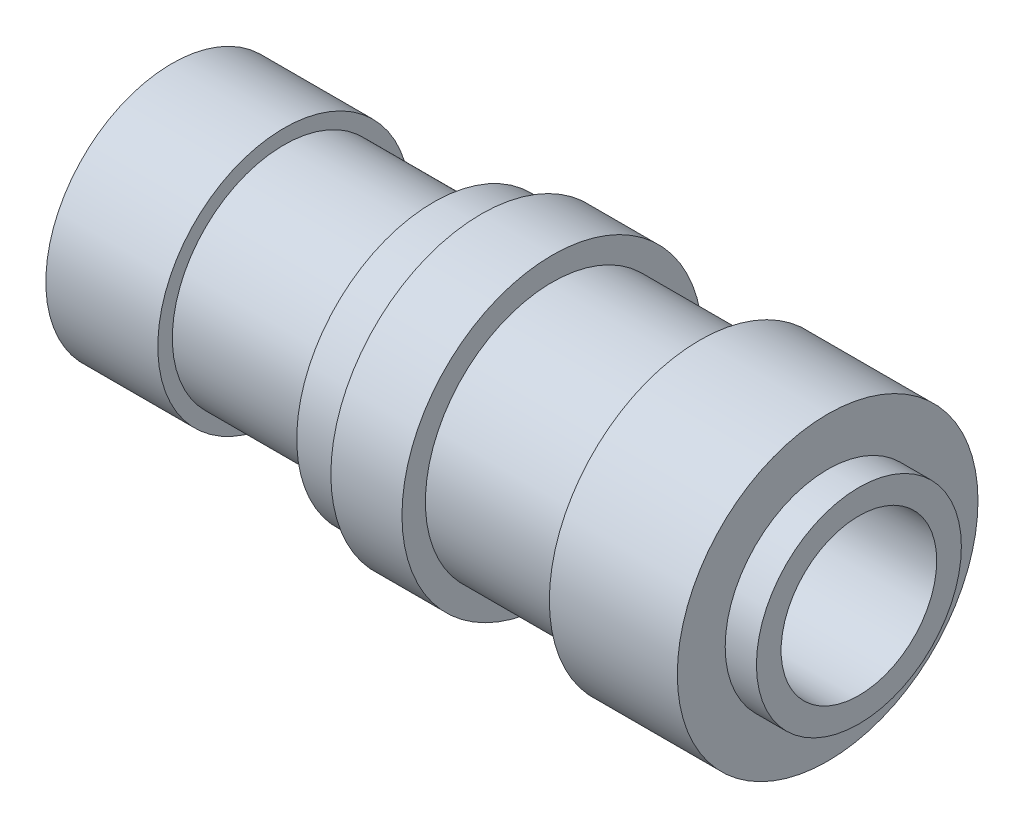
from build123d import *

# Parameters (mm, degrees)
CUT_EXTRUDE1_DEPTH      = 69.067346778
CUT_EXTRUDE1_DEPTH_BACK = 69.067346778
SKETCH3_R               = 7.366


with BuildPart() as part:
    # Sketch2 → Revolve1 (revolve)
    with BuildSketch(Plane(origin=(0, 0, 0), x_dir=(1, 0, 0), z_dir=(0, 1, 0))):
        Polygon((-5.831340186, 11.938), (4.767118223, 11.938), (4.767118223, 10.563948577), (18.927664498, 10.563948577), (18.927664498, 12.948727397), (23.441288756, 12.948727397), (23.441288756, 14.231007016), (30.170692197, 14.231007016), (30.170692197, 12.013405261), (44.121894451, 12.013405261), (44.121894451, 14.231007016), (56.23516923, 14.231007016), (56.23516923, 9.700025704), (59.192659814, 9.700025704), (59.192659814, 0), (-5.831340186, 0), align=None)
    revolve(axis=Axis((59.192659814, 0, 0), (-1, 0, 0)))

    # Sketch3 → Cut-Extrude1 (cut, two sides: drawn at the far end of the back side and taken through both)
    with BuildSketch(Plane(origin=(59.192659814, 0, 0), x_dir=(0, 0, -1), z_dir=(1, 0, 0)).offset(-CUT_EXTRUDE1_DEPTH_BACK)):
        Circle(SKETCH3_R)
    extrude(amount=CUT_EXTRUDE1_DEPTH + CUT_EXTRUDE1_DEPTH_BACK, mode=Mode.SUBTRACT)


solid = part.part
